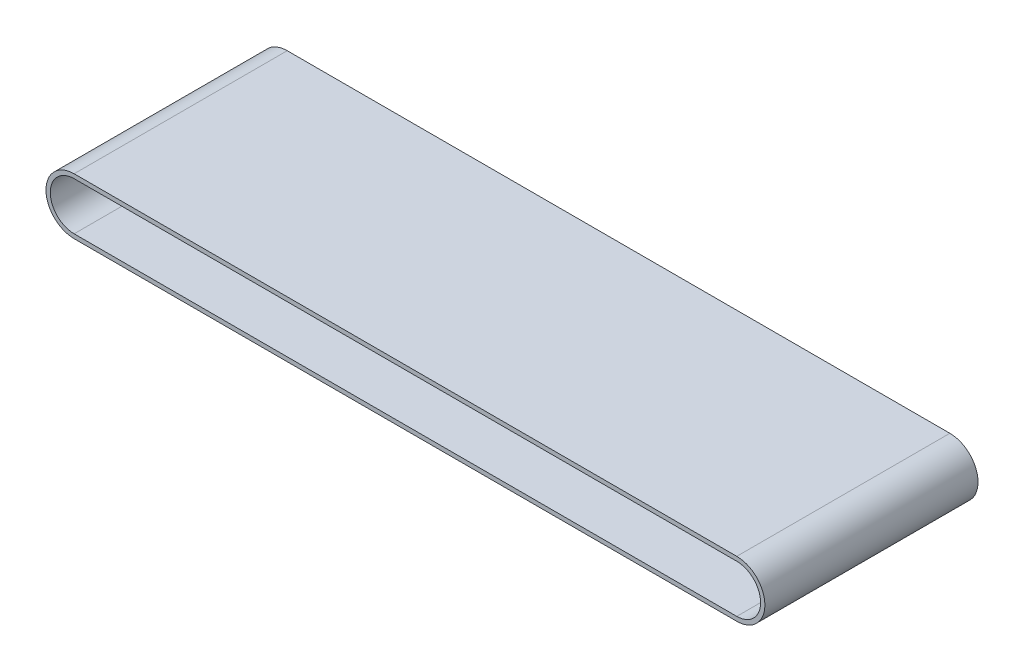
from build123d import *

# Parameters (mm, degrees)
EXTRUDE_THIN1_DEPTH = 150


with BuildPart() as part:
    # Sketch8 → Extrude-Thin1 (new body)
    with BuildSketch(Plane.XY):
        with BuildLine():
            Line((733.103706938, 25.81537776), (266.703706938, 25.81537776))
            ThreePointArc((266.703706938, 25.81537776), (246.903706938, 45.61537776), (266.703706938, 65.41537776))
            Line((266.703706938, 65.41537776), (733.103706938, 65.41537776))
            ThreePointArc((733.103706938, 65.41537776), (752.903706938, 45.61537776), (733.103706938, 25.81537776))
        make_face()
        with BuildLine():
            Line((733.103706938, 28.81537776), (266.703706938, 28.81537776))
            ThreePointArc((266.703706938, 28.81537776), (249.903706938, 45.61537776), (266.703706938, 62.41537776))
            Line((266.703706938, 62.41537776), (733.103706938, 62.41537776))
            ThreePointArc((733.103706938, 62.41537776), (749.903706938, 45.61537776), (733.103706938, 28.81537776))
        make_face(mode=Mode.SUBTRACT)
    extrude(amount=EXTRUDE_THIN1_DEPTH)


solid = part.part
